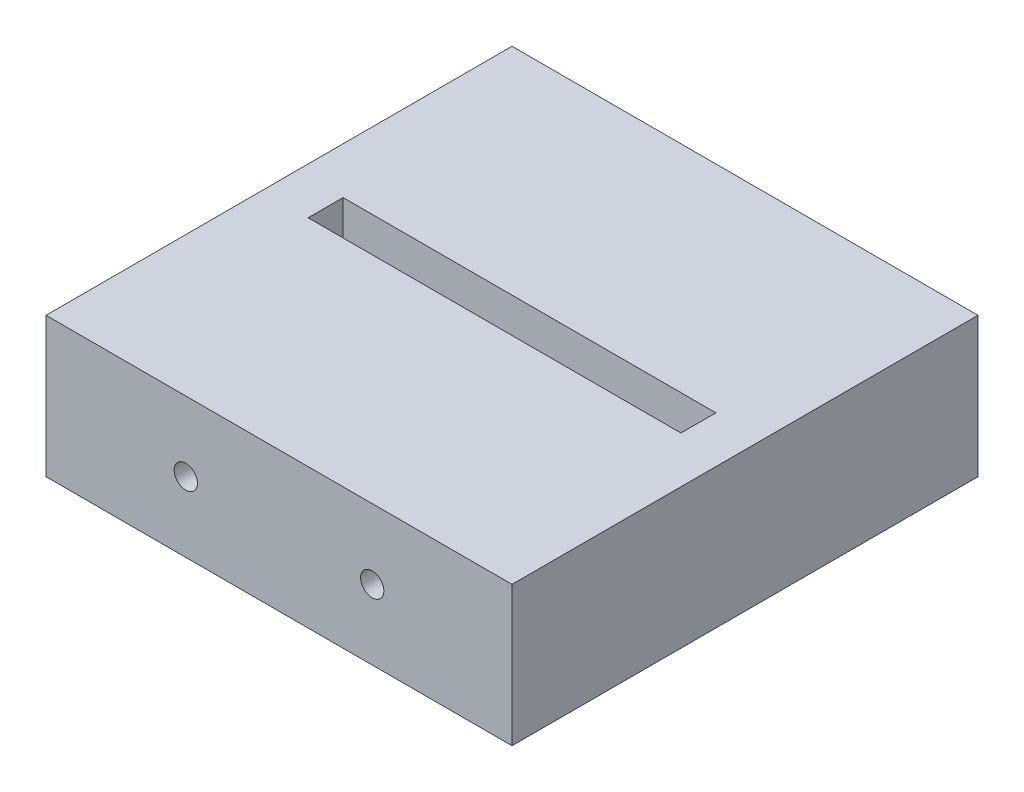
from build123d import *

# Parameters (mm, degrees)
SKETCH1_W           = 127
SKETCH1_H           = 127
BOSS_EXTRUDE1_DEPTH = 38.1
SKETCH2_W           = 101.6
SKETCH2_H           = 9.525
CUT_EXTRUDE1_DEPTH  = 98.550550998
SKETCH3_R           = 3.175
CUT_EXTRUDE2_DEPTH  = 148.013128665


with BuildPart() as part:
    # Sketch1 → Boss-Extrude1 (new body)
    with BuildSketch(Plane(origin=(0, 0, 0), x_dir=(1, 0, 0), z_dir=(0, 1, 0))):
        Rectangle(SKETCH1_W, SKETCH1_H)
    extrude(amount=BOSS_EXTRUDE1_DEPTH)

    # Sketch2 → Cut-Extrude1 (cut, through all)
    with BuildSketch(Plane(origin=(0, 0, 0), x_dir=(-1, 0, 0), z_dir=(0, -1, 0))):
        Rectangle(SKETCH2_W, SKETCH2_H)
    extrude(amount=-CUT_EXTRUDE1_DEPTH, mode=Mode.SUBTRACT)

    # Sketch3 → Cut-Extrude2 (cut, through all)
    with BuildSketch(Plane.XY.offset(63.5)):
        with Locations((-25.4, 19.05)):
            Circle(SKETCH3_R)
        with Locations(Location((25.4, 19.05, 0), (0, 0, 180))):
            Circle(SKETCH3_R)
    extrude(amount=-CUT_EXTRUDE2_DEPTH, mode=Mode.SUBTRACT)


solid = part.part
